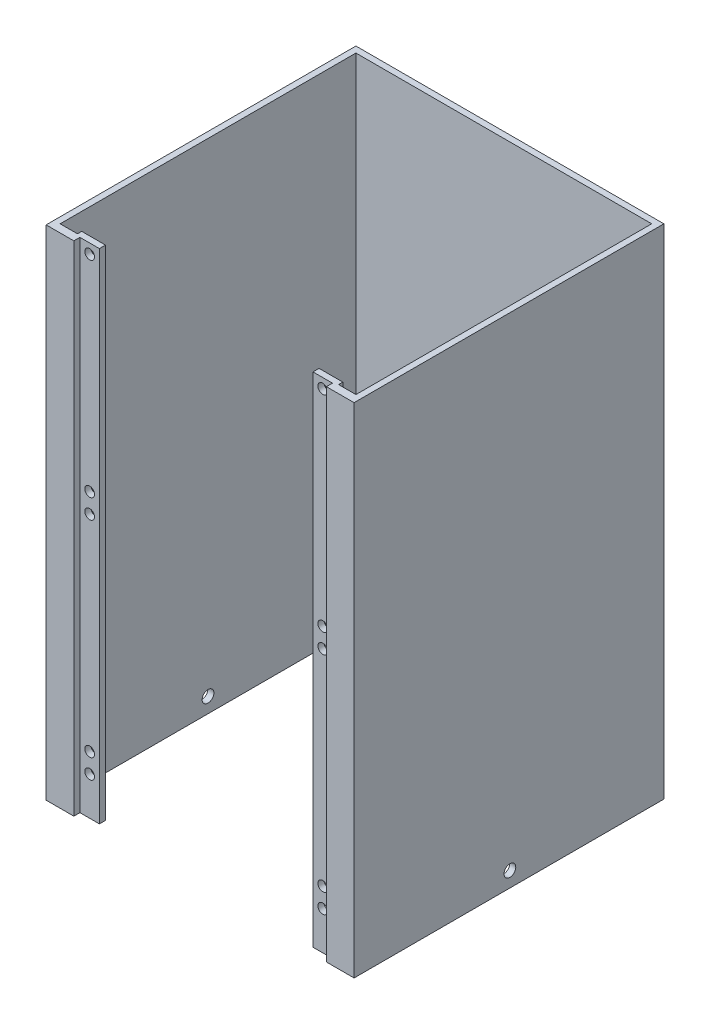
from build123d import *

# Parameters (mm, degrees)
BOSS_EXTRUDE1_DEPTH = 327.5
SKETCH2_R           = 1.6
CUT_EXTRUDE2_DEPTH  = 10
SKETCH3_R           = 1.93
CUT_EXTRUDE3_DEPTH  = 102
SKETCH4_R           = 1.93
CUT_EXTRUDE4_DEPTH  = 10
SKETCH5_W           = 116.752499477
SKETCH5_H           = 165.661363519
CUT_EXTRUDE5_DEPTH  = 191
SKETCH6_W           = 83
SKETCH6_H           = 2.003
CUT_EXTRUDE6_DEPTH  = 203


with BuildPart() as part:
    # Sketch1 → Boss-Extrude1 (new body)
    with BuildSketch(Plane(origin=(0, 0, 0), x_dir=(1, 0, 0), z_dir=(0, 1, 0))):
        Polygon((0, -0.603), (0, 101.206), (101.206, 101.206), (101.206, -0.6), (91.5, -0.6), (91.5, 1.4), (85.703, 1.4), (85.703, 3.4), (93.5, 3.4), (93.5, 2), (99.206, 2), (99.206, 99.206), (2, 99.206), (2, 2), (7.706, 2), (7.706, 3.397), (15.503, 3.397), (15.503, 1.397), (9.706, 1.397), (9.706, -0.603), align=None)
    extrude(amount=BOSS_EXTRUDE1_DEPTH)

    # Sketch2 → Cut-Extrude2 (cut)
    with BuildSketch(Plane.XY.offset(-1.397)):
        with Locations((12.303, 314.9)):
            Circle(SKETCH2_R)
        with Locations((12.303, 308.5)):
            Circle(SKETCH2_R)
        with Locations((88.903, 314.9)):
            Circle(SKETCH2_R)
        with Locations((88.903, 308.5)):
            Circle(SKETCH2_R)
        with Locations((12.303, 240.925)):
            Circle(SKETCH2_R)
        with Locations((12.303, 234.525)):
            Circle(SKETCH2_R)
        with Locations((88.903, 240.925)):
            Circle(SKETCH2_R)
        with Locations((88.903, 234.525)):
            Circle(SKETCH2_R)
        with Locations((12.303, 166.95)):
            Circle(SKETCH2_R)
        with Locations((12.303, 160.55)):
            Circle(SKETCH2_R)
        with Locations((88.903, 166.95)):
            Circle(SKETCH2_R)
        with Locations((88.903, 160.55)):
            Circle(SKETCH2_R)
        with Locations((12.303, 92.975)):
            Circle(SKETCH2_R)
        with Locations((12.303, 86.575)):
            Circle(SKETCH2_R)
        with Locations((88.903, 92.975)):
            Circle(SKETCH2_R)
        with Locations((88.903, 86.575)):
            Circle(SKETCH2_R)
        with Locations((12.303, 19)):
            Circle(SKETCH2_R)
        with Locations((12.303, 12.6)):
            Circle(SKETCH2_R)
        with Locations((88.903, 19)):
            Circle(SKETCH2_R)
        with Locations((88.903, 12.6)):
            Circle(SKETCH2_R)
    extrude(amount=-CUT_EXTRUDE2_DEPTH, mode=Mode.SUBTRACT)

    # Sketch3 → Cut-Extrude3 (cut)
    with BuildSketch(Plane(origin=(101.206, 0, 0), x_dir=(0, 0, -1), z_dir=(1, 0, 0))):
        with Locations((50.603, 322.524)):
            Circle(SKETCH3_R)
        with Locations((50.603, 4.976)):
            Circle(SKETCH3_R)
    extrude(amount=-CUT_EXTRUDE3_DEPTH, mode=Mode.SUBTRACT)

    # Sketch4 → Cut-Extrude4 (cut)
    with BuildSketch(Plane(origin=(0, 0, -101.206), x_dir=(-1, 0, 0), z_dir=(0, 0, -1))):
        with Locations((-50.603, 322.524)):
            Circle(SKETCH4_R)
        with Locations((-50.603, 4.976)):
            Circle(SKETCH4_R)
    extrude(amount=-CUT_EXTRUDE4_DEPTH, mode=Mode.SUBTRACT)

    # Sketch5 → Cut-Extrude5 (cut)
    with BuildSketch(Plane.ZY):
        with Locations((-42.829750262, 246.58068176)):
            Rectangle(SKETCH5_W, SKETCH5_H)
    extrude(amount=-CUT_EXTRUDE5_DEPTH, mode=Mode.SUBTRACT)

    # Sketch6 → Cut-Extrude6 (cut)
    with BuildSketch(Plane(origin=(0, 163.75, 0), x_dir=(1, 0, 0), z_dir=(0, 1, 0))):
        with Locations((50.603, 0.3985)):
            Rectangle(SKETCH6_W, SKETCH6_H)
    extrude(amount=-CUT_EXTRUDE6_DEPTH, mode=Mode.SUBTRACT)


solid = part.part
